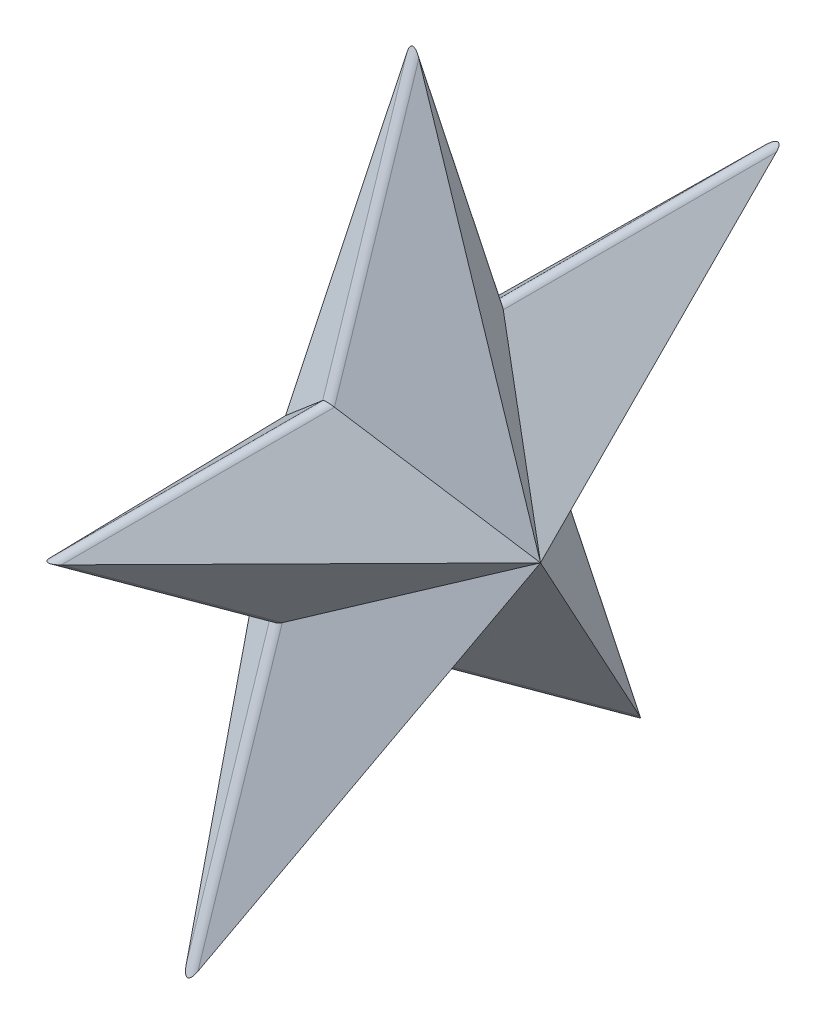
from build123d import *

# Parameters (mm, degrees)
FILLET1_R = 0.254
FILLET2_R = 0.254


with BuildPart() as part:
    # Sketch3 → Loft4 section 0
    with BuildSketch(Plane(origin=(0, 0, 0), x_dir=(0, 0, -1), z_dir=(1, 0, 0)), mode=Mode.PRIVATE) as loft4_s0:
        with BuildLine():
            Line((0, 21.298547486), (2.643326102, 13.163226257))
            Line((2.643326102, 13.163226257), (11.197309056, 13.163226257))
            Line((11.197309056, 13.163226257), (4.276991477, 8.135321229))
            Line((4.276991477, 8.135321229), (6.920317579, 0))
            Line((6.920317579, 0), (0, 5.027905029))
            Line((0, 5.027905029), (-6.920317579, 0))
            Line((-6.920317579, 0), (-4.276991477, 8.135321229))
            Line((-4.276991477, 8.135321229), (-11.197309056, 13.163226257))
            Line((-11.197309056, 13.163226257), (-2.643326102, 13.163226257))
            Line((-2.643326102, 13.163226257), (0, 21.298547486))
        make_face()
    loft([loft4_s0.sketch, Vertex(3.81, 9.525, 0)])

    # Sketch3<3> → Loft5 section 0
    with BuildSketch(Plane(origin=(0, 0, 0), x_dir=(0, 0, -1), z_dir=(1, 0, 0)), mode=Mode.PRIVATE) as loft5_s0:
        with BuildLine():
            Line((0, 21.298547486), (2.643326102, 13.163226257))
            Line((2.643326102, 13.163226257), (11.197309056, 13.163226257))
            Line((11.197309056, 13.163226257), (4.276991477, 8.135321229))
            Line((4.276991477, 8.135321229), (6.920317579, 0))
            Line((6.920317579, 0), (0, 5.027905029))
            Line((0, 5.027905029), (-6.920317579, 0))
            Line((-6.920317579, 0), (-4.276991477, 8.135321229))
            Line((-4.276991477, 8.135321229), (-11.197309056, 13.163226257))
            Line((-11.197309056, 13.163226257), (-2.643326102, 13.163226257))
            Line((-2.643326102, 13.163226257), (0, 21.298547486))
        make_face()
    loft([Vertex(-3.81, 9.525, 0), loft5_s0.sketch])

    # Fillet1
    fillet1_edges = [part.edges().sort_by_distance(p)[0] for p in [
        (0, 17.230886871, -1.321663051),
        (0, 13.163226257, -6.920317579),
    ]]
    fillet(fillet1_edges, radius=FILLET1_R)

    # Fillet2
    fillet2_edges = [part.edges().sort_by_distance(p)[0] for p in [
        (0, 17.152245473, 1.34721519),
        (0, 13.163226257, 6.920317579),
        (0, 10.649273743, 7.737150267),
        (0, 4.067660614, 5.598654528),
        (0, 2.513952514, 3.46015879),
        (0, 2.513952514, -3.46015879),
        (0, 4.067660614, -5.598654528),
        (0, 10.600670686, -7.670253897),
    ]]
    fillet(fillet2_edges, radius=FILLET2_R)


solid = part.part
